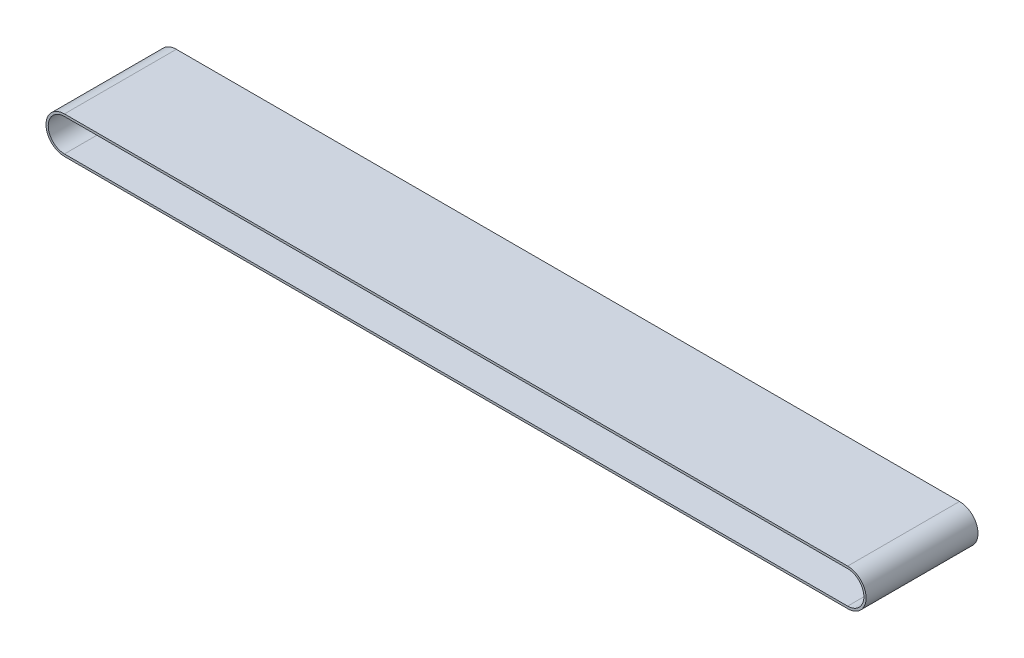
from build123d import *

# Parameters (mm, degrees)
EXTRUDE_THIN1_DEPTH = 50


with BuildPart() as part:
    # Sketch2 → Extrude-Thin1 (new, symmetric)
    with BuildSketch(Plane.XY):
        with BuildLine():
            Line((-700, 16.5), (0, 16.5))
            ThreePointArc((0, 16.5), (16.5, 0), (0, -16.5))
            Line((0, -16.5), (-700, -16.5))
            ThreePointArc((-700, -16.5), (-716.5, 0), (-700, 16.5))
        make_face()
        with BuildLine():
            Line((-700, 14.5), (0, 14.5))
            ThreePointArc((0, 14.5), (14.5, 0), (0, -14.5))
            Line((0, -14.5), (-700, -14.5))
            ThreePointArc((-700, -14.5), (-714.5, 0), (-700, 14.5))
        make_face(mode=Mode.SUBTRACT)
    extrude(amount=EXTRUDE_THIN1_DEPTH, both=True)


solid = part.part
